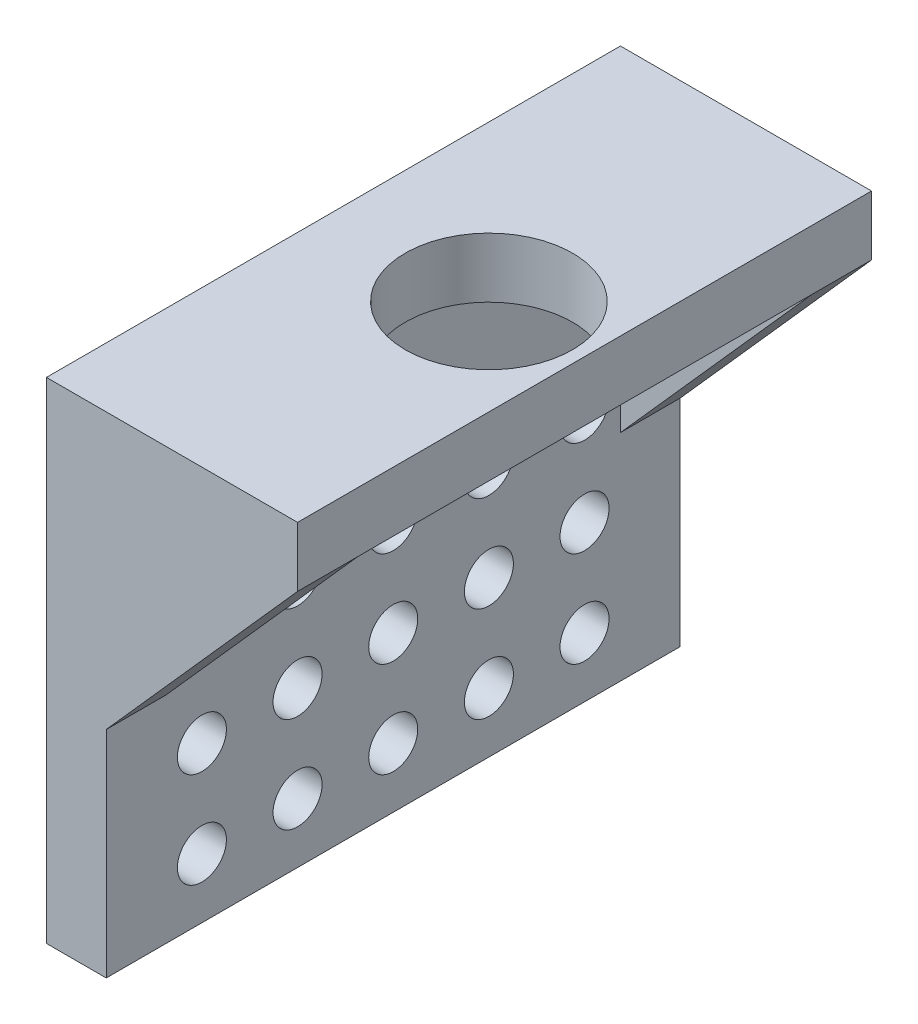
from build123d import *

# Parameters (mm, degrees)
SKETCH1_W           = 21
SKETCH1_H           = 48
SKETCH1_R           = 7
BOSS_EXTRUDE1_DEPTH = 5
SKETCH2_W           = 5
SKETCH2_H           = 48
BOSS_EXTRUDE2_DEPTH = 36
SKETCH4_W           = 16
SKETCH4_H           = 5
BOSS_EXTRUDE3_DEPTH = 18
CUT_EXTRUDE1_DEPTH  = 64.568860301
SKETCH6_R           = 2.05
CUT_EXTRUDE2_DEPTH  = 18


with BuildPart() as part:
    # Sketch1 → Boss-Extrude1 (new body)
    with BuildSketch(Plane(origin=(0, 0, 0), x_dir=(1, 0, 0), z_dir=(0, 1, 0))):
        with Locations((10.5, -24)):
            Rectangle(SKETCH1_W, SKETCH1_H)
        with Locations(Location((13, -24, 0), (0, 0, 270))):
            Circle(SKETCH1_R, mode=Mode.SUBTRACT)
    extrude(amount=BOSS_EXTRUDE1_DEPTH)

    # Sketch2 → Boss-Extrude2 (add)
    with BuildSketch(Plane.XZ):
        with Locations((2.5, 24)):
            Rectangle(SKETCH2_W, SKETCH2_H)
    extrude(amount=BOSS_EXTRUDE2_DEPTH)

    # Sketch4 → Boss-Extrude3 (add)
    with BuildSketch(Plane.XZ):
        with Locations((13, 45.5)):
            Rectangle(SKETCH4_W, SKETCH4_H)
        with Locations((13, 2.5)):
            Rectangle(SKETCH4_W, SKETCH4_H)
    extrude(amount=BOSS_EXTRUDE3_DEPTH)

    # Sketch5 → Cut-Extrude1 (cut, through all)
    with BuildSketch(Plane.XY.offset(48)):
        Polygon((21, 0), (5, -18), (21, -18), align=None)
    extrude(amount=-CUT_EXTRUDE1_DEPTH, mode=Mode.SUBTRACT)

    # Sketch6 → Cut-Extrude2 (cut)
    with BuildSketch(Plane.ZY):
        with Locations((8, -31)):
            Circle(SKETCH6_R)
        with Locations((16, -31)):
            Circle(SKETCH6_R)
        with Locations((24, -31)):
            Circle(SKETCH6_R)
        with Locations((32, -31)):
            Circle(SKETCH6_R)
        with Locations((40, -31)):
            Circle(SKETCH6_R)
        with Locations((16, -23)):
            Circle(SKETCH6_R)
        with Locations((24, -23)):
            Circle(SKETCH6_R)
        with Locations((32, -23)):
            Circle(SKETCH6_R)
        with Locations((40, -23)):
            Circle(SKETCH6_R)
        with Locations((16, -15)):
            Circle(SKETCH6_R)
        with Locations((24, -15)):
            Circle(SKETCH6_R)
        with Locations((32, -15)):
            Circle(SKETCH6_R)
        with Locations((40, -15)):
            Circle(SKETCH6_R)
        with Locations((8, -23)):
            Circle(SKETCH6_R)
        with Locations((8, -15)):
            Circle(SKETCH6_R)
    extrude(amount=-CUT_EXTRUDE2_DEPTH, mode=Mode.SUBTRACT)


solid = part.part
